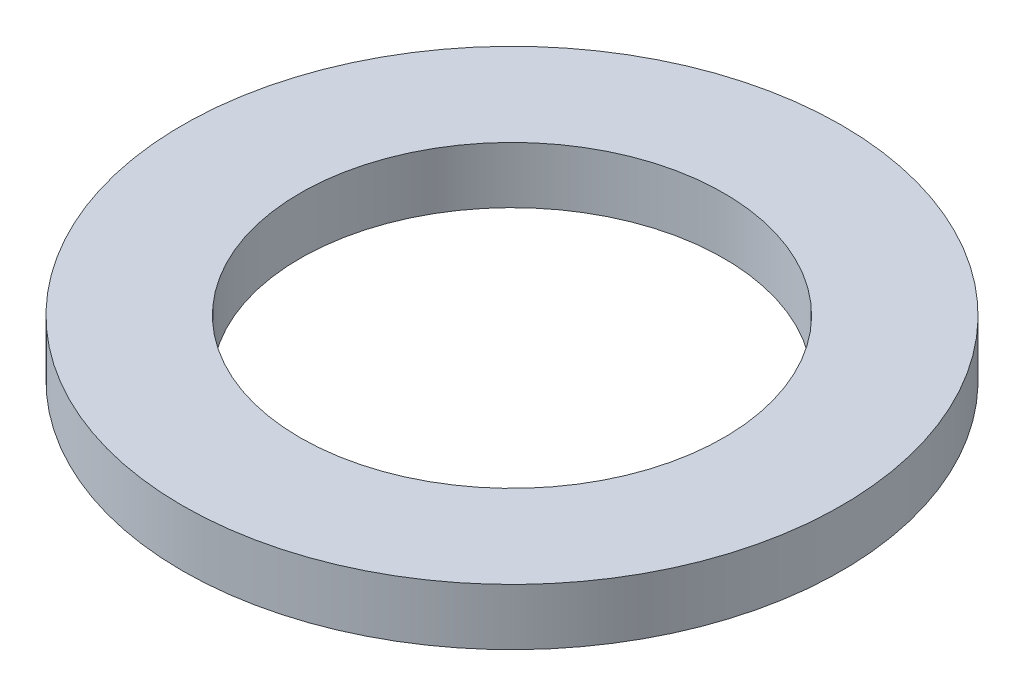
from build123d import *

# Parameters (mm, degrees)
SKIZZE1_R                       = 17.5
AUFSATZ_LINEAR_AUSTRAGEN1_DEPTH = 3
SKIZZE2_R                       = 11.25
SCHNITT_LINEAR_AUSTRAGEN1_DEPTH = 25.929901725


with BuildPart() as part:
    # Skizze1 → Aufsatz-Linear austragen1 (new body)
    with BuildSketch(Plane(origin=(0, 0, 0), x_dir=(1, 0, 0), z_dir=(0, 1, 0))):
        with Locations(Location((0, 0, 0), (0, 0, 270))):
            Circle(SKIZZE1_R)
    extrude(amount=AUFSATZ_LINEAR_AUSTRAGEN1_DEPTH)

    # Skizze2 → Schnitt-Linear austragen1 (cut, through all)
    with BuildSketch(Plane(origin=(0, 3, 0), x_dir=(1, 0, 0), z_dir=(0, 1, 0))):
        with Locations(Location((0, 0, 0), (0, 0, 270))):
            Circle(SKIZZE2_R)
    extrude(amount=-SCHNITT_LINEAR_AUSTRAGEN1_DEPTH, mode=Mode.SUBTRACT)


solid = part.part
